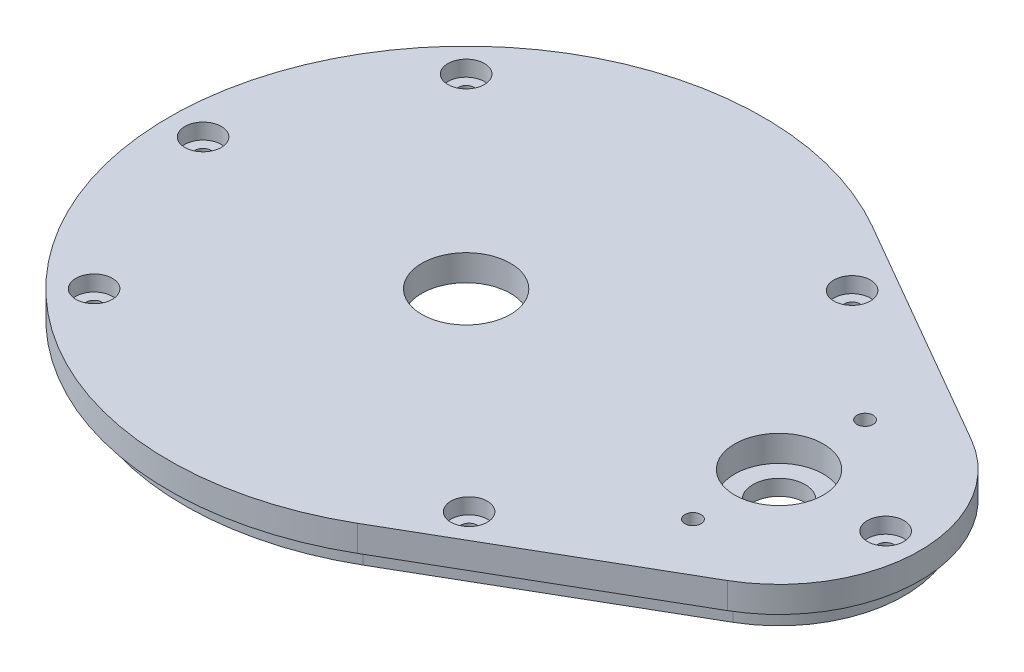
from build123d import *

# Parameters (mm, degrees)
SKETCH1_R           = 8.5
SKETCH1_R_2         = 1.55
BOSS_EXTRUDE1_DEPTH = 5
SKETCH2_R           = 12
SKETCH2_R_2         = 5
BOSS_EXTRUDE2_DEPTH = 3
BOSS_EXTRUDE3_DEPTH = 4
SKETCH5_R           = 1.55
CUT_EXTRUDE1_DEPTH  = 5
SKETCH6_R           = 3.5
CUT_EXTRUDE2_DEPTH  = 3


with BuildPart() as part:
    # Sketch1 → Boss-Extrude1 (new body)
    with BuildSketch(Plane(origin=(0, 0, 0), x_dir=(1, 0, 0), z_dir=(0, 1, 0))):
        with BuildLine():
            Line((13.5, -49.363448016), (58.5, -23.382685902))
            ThreePointArc((58.5, -23.382685902), (72, 0), (58.5, 23.382685902))
            Line((58.5, 23.382685902), (13.5, 49.363448016))
            ThreePointArc((13.5, 49.363448016), (-72, 0), (13.5, -49.363448016))
        make_face()
        with Locations(Location((-15, 0, 0), (0, 0, 270))):
            Circle(SKETCH1_R, mode=Mode.SUBTRACT)
        with Locations(Location((45, 0, 0), (0, 0, 270))):
            Circle(SKETCH1_R, mode=Mode.SUBTRACT)
        with Locations(Location((45, 16.5, 0), (0, 0, 270))):
            Circle(SKETCH1_R_2, mode=Mode.SUBTRACT)
        with Locations(Location((45, -16.5, 0), (0, 0, 270))):
            Circle(SKETCH1_R_2, mode=Mode.SUBTRACT)
    extrude(amount=BOSS_EXTRUDE1_DEPTH)

    # Sketch2 → Boss-Extrude2 (add)
    with BuildSketch(Plane.XZ):
        with Locations(Location((45, 0, 0), (0, 0, 90))):
            Circle(SKETCH2_R)
        with Locations(Location((45, 0, 0), (0, 0, 270))):
            Circle(SKETCH2_R_2, mode=Mode.SUBTRACT)
    extrude(amount=BOSS_EXTRUDE2_DEPTH)

    # Sketch4 → Boss-Extrude3 (add)
    with BuildSketch(Plane.XZ):
        with BuildLine():
            Line((12, 46.765371804), (57, 20.784609691))
            ThreePointArc((57, 20.784609691), (69, 0), (57, -20.784609691))
            Line((57, -20.784609691), (12, -46.765371804))
            ThreePointArc((12, -46.765371804), (-69, 0), (12, 46.765371804))
        make_face()
        with BuildLine():
            Line((11, -45.033320997), (56, -19.052558883))
            ThreePointArc((56, -19.052558883), (67, 0), (56, 19.052558883))
            Line((56, 19.052558883), (11, 45.033320997))
            ThreePointArc((11, 45.033320997), (-67, 0), (11, -45.033320997))
        make_face(mode=Mode.SUBTRACT)
    extrude(amount=BOSS_EXTRUDE3_DEPTH)

    # Sketch5 → Cut-Extrude1 (cut)
    with BuildSketch(Plane(origin=(0, 5, 0), x_dir=(1, 0, 0), z_dir=(0, 1, 0))):
        with Locations(Location((-65.45, 0, 0), (0, 0, 270))):
            Circle(SKETCH5_R)
        with Locations(Location((65.45, 0, 0), (0, 0, 270))):
            Circle(SKETCH5_R)
        with Locations(Location((-50.673537111, -35.673537111, 0), (0, 0, 270))):
            Circle(SKETCH5_R)
        with Locations(Location((22.284740181, 36.728311109, 0), (0, 0, 270))):
            Circle(SKETCH5_R)
        with Locations(Location((22.291641994, -36.724302618, 0), (0, 0, 270))):
            Circle(SKETCH5_R)
        with Locations(Location((-50.673537111, 35.673537111, 0), (0, 0, 270))):
            Circle(SKETCH5_R)
    extrude(amount=-CUT_EXTRUDE1_DEPTH, mode=Mode.SUBTRACT)

    # Sketch6 → Cut-Extrude2 (cut)
    with BuildSketch(Plane(origin=(0, 5, 0), x_dir=(1, 0, 0), z_dir=(0, 1, 0))):
        with Locations(Location((-50.673537111, 35.673537111, 0), (0, 0, 270))):
            Circle(SKETCH6_R)
        with Locations(Location((-65.45, 0, 0), (0, 0, 270))):
            Circle(SKETCH6_R)
        with Locations(Location((-50.673537111, -35.673537111, 0), (0, 0, 270))):
            Circle(SKETCH6_R)
        with Locations(Location((22.291641994, -36.724302618, 0), (0, 0, 270))):
            Circle(SKETCH6_R)
        with Locations(Location((22.284740181, 36.728311109, 0), (0, 0, 270))):
            Circle(SKETCH6_R)
        with Locations(Location((65.45, 0, 0), (0, 0, 270))):
            Circle(SKETCH6_R)
    extrude(amount=-CUT_EXTRUDE2_DEPTH, mode=Mode.SUBTRACT)


solid = part.part
